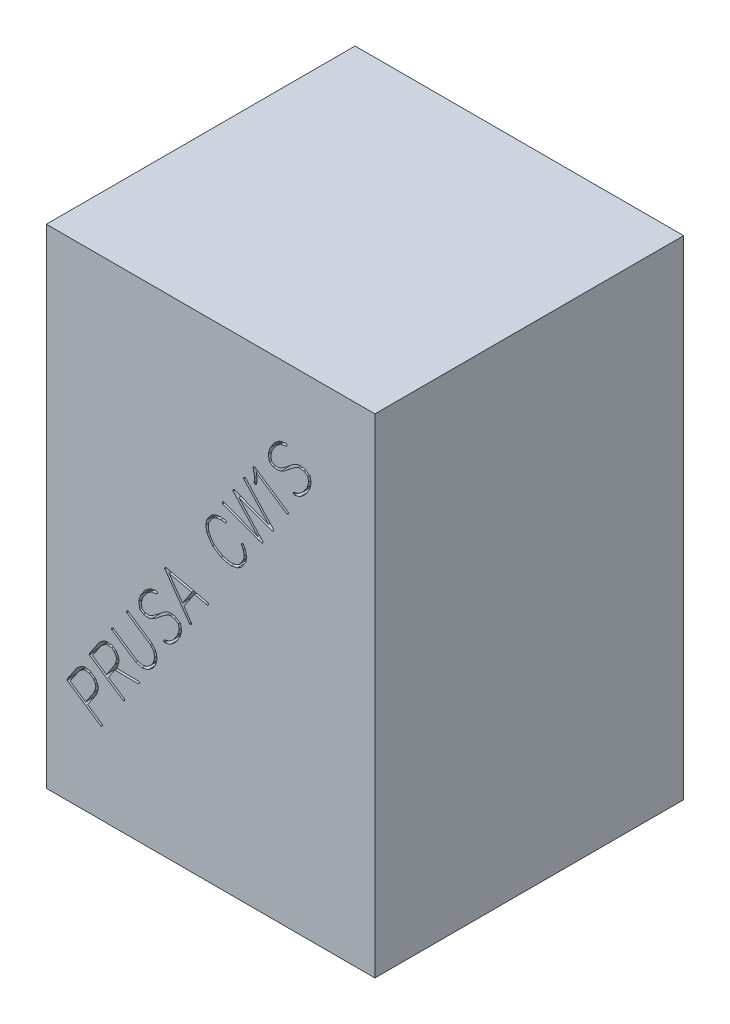
from build123d import *

# Parameters (mm, degrees)
SKETCH1_W           = 232
SKETCH1_H           = 218
BOSS_EXTRUDE1_DEPTH = 345
CUT_EXTRUDE1_DEPTH  = 10


with BuildPart() as part:
    # Sketch1 → Boss-Extrude1 (new body)
    with BuildSketch(Plane(origin=(0, 0, 0), x_dir=(1, 0, 0), z_dir=(0, 1, 0))):
        Rectangle(SKETCH1_W, SKETCH1_H)
    extrude(amount=BOSS_EXTRUDE1_DEPTH)

    # Sketch2 → Cut-Extrude1 (cut)
    # profile 1 of 9: a face of its own
    with BuildSketch(Plane.XY.offset(109)):
        with BuildLine():
            add(Edge.make_bspline(
                [(-94.375270418, 84.594757392), (-94.2712399, 84.673064857), (-94.052477044, 84.83773543), (-93.702444127, 85.095218624), (-93.320108696, 85.384684484), (-92.901429823, 85.702566451), (-92.449607078, 86.048797005), (-91.961674192, 86.423793584), (-91.441155818, 86.830251619), (-91.079341394, 87.108039316), (-90.893127561, 87.251007392)],
                knots=[0, 0, 0, 0, 0.713517633, 1.500436215, 2.381123196, 3.341333545, 4.381080633, 5.50037498, 6.713526257, 8, 8, 8, 8], degree=3))
            add(Edge.make_bspline(
                [(-90.893127561, 87.251007392), (-90.854066238, 87.260311771), (-90.759262333, 87.282893995), (-90.594154664, 87.322097448), (-90.380184097, 87.366758937), (-90.11725252, 87.41549258), (-89.804813618, 87.477215932), (-89.442757345, 87.551311043), (-89.03078555, 87.626728998), (-88.740896895, 87.684037582), (-88.588440061, 87.714177034)],
                knots=[0, 0, 0, 0, 0.409916446, 0.994889001, 1.732288869, 2.640988027, 3.724693493, 4.983422994, 6.413536459, 8, 8, 8, 8], degree=3))
            Line((-88.588440061, 87.714177034), (-85.262547203, 87.239846677))
            add(Edge.make_bspline(
                [(-85.262547203, 87.239846677), (-85.150572528, 87.169731396), (-84.912220621, 87.020482372), (-84.54141555, 86.771028734), (-84.119568016, 86.507439492), (-83.667087428, 86.204818258), (-83.170440355, 85.880254314), (-82.636932741, 85.521641908), (-82.057758208, 85.140404352), (-81.6610719, 84.872341974), (-81.456743632, 84.73426632)],
                knots=[0, 0, 0, 0, 0.69580788, 1.481112893, 2.353503564, 3.31542659, 4.347997152, 5.478374533, 6.701141545, 8, 8, 8, 8], degree=3))
            add(Edge.make_bspline(
                [(-81.456743632, 84.73426632), (-81.35119795, 84.544262041), (-81.118599691, 84.12553658), (-80.725139427, 83.444457955), (-80.263829164, 82.64723715), (-79.928231276, 82.079581368), (-79.749154346, 81.776677034)],
                knots=[0, 0, 0, 0, 0.76368351, 1.682981731, 2.763625957, 4, 4, 4, 4], degree=3))
            Line((-79.749154346, 81.776677034), (-79.297145418, 79.555694892))
            add(Edge.make_bspline(
                [(-79.297145418, 79.555694892), (-79.332261519, 79.429142852), (-79.407207073, 79.159052714), (-79.531481816, 78.73031717), (-79.66471833, 78.250201766), (-79.80934281, 77.721799304), (-79.964900858, 77.144462712), (-80.139566112, 76.520433501), (-80.32316466, 75.845052723), (-80.448681971, 75.377900455), (-80.513663275, 75.136052034)],
                knots=[0, 0, 0, 0, 0.68759803, 1.467486793, 2.337019029, 3.296221514, 4.33571337, 5.46746033, 6.688884203, 8, 8, 8, 8], degree=3))
            Line((-80.513663275, 75.136052034), (-86.864109703, 65.688507392))
            Line((-86.864109703, 65.688507392), (-76.702279346, 58.863730606))
            add(Edge.make_bspline(
                [(-76.702279346, 58.863730606), (-76.658833372, 58.805797542), (-76.571754559, 58.68968224), (-76.485637607, 58.484091426), (-76.454528133, 58.254402691), (-76.46332192, 58.097354076), (-76.467904346, 58.01551632)],
                knots=[0, 0, 0, 0, 0.957114713, 1.918346067, 2.915253814, 4, 4, 4, 4], degree=3))
            Line((-76.467904346, 58.01551632), (-76.629734703, 57.775560963))
            add(Edge.make_bspline(
                [(-76.629734703, 57.775560963), (-76.705152591, 57.677791819), (-76.845109131, 57.496356993), (-77.137601396, 57.336182511), (-77.450514723, 57.327720771), (-77.623780537, 57.420982228), (-77.712323989, 57.46864132)],
                knots=[0, 0, 0, 0, 1.162853208, 2.157961697, 3.058669304, 4, 4, 4, 4], degree=3))
            Line((-77.712323989, 57.46864132), (-101.283752561, 73.305694892))
            add(Edge.make_bspline(
                [(-101.283752561, 73.305694892), (-101.328906716, 73.372338548), (-101.416293831, 73.501314426), (-101.47531743, 73.728693005), (-101.454021207, 73.965272417), (-101.397441574, 74.114101566), (-101.367457918, 74.192971677)],
                knots=[0, 0, 0, 0, 1.021013707, 1.975974124, 2.927393266, 4, 4, 4, 4], degree=3))
            Line((-101.367457918, 74.192971677), (-94.375270418, 84.594757392))
        make_face()
        Polygon((-89.961207918, 85.599221677), (-92.969020418, 83.261052034), (-99.235761489, 74.003239534), (-88.292681132, 66.64832882), (-82.104065061, 75.861498463), (-81.060538275, 79.61707882), (-81.389779346, 81.118194892), (-82.701163275, 83.517748463), (-85.697815061, 85.526677034), (-88.393127561, 85.872659177), align=None, mode=Mode.SUBTRACT)
    # profile 2 of 9: a face of its own
    with BuildSketch(Plane.XY.offset(109)):
        with BuildLine():
            add(Edge.make_bspline(
                [(-78.630961255, 108.007630931), (-78.526931154, 108.085938941), (-78.308169171, 108.250610658), (-77.95812889, 108.508084206), (-77.575826263, 108.797593041), (-77.157007382, 109.115291583), (-76.704602587, 109.463193695), (-76.213924195, 109.83515514), (-75.689600047, 110.237246637), (-75.329191449, 110.51499556), (-75.143238041, 110.658300574)],
                knots=[0, 0, 0, 0, 0.713351082, 1.500085978, 2.380567386, 3.3405536, 4.380057987, 5.50718218, 6.71382655, 8, 8, 8, 8], degree=3))
            add(Edge.make_bspline(
                [(-75.143238041, 110.658300574), (-75.104174837, 110.667595558), (-75.009366364, 110.690154979), (-74.844308648, 110.729607821), (-74.627919642, 110.773340768), (-74.364243732, 110.829497772), (-74.049893909, 110.89111632), (-73.688269415, 110.955884019), (-73.277552081, 111.035983461), (-72.987373392, 111.091780683), (-72.832970184, 111.121470216)],
                knots=[0, 0, 0, 0, 0.408958171, 0.992563217, 1.728239241, 2.657105448, 3.738277501, 4.990486884, 6.398647109, 8, 8, 8, 8], degree=3))
            Line((-72.832970184, 111.121470216), (-69.495916612, 110.641559502))
            add(Edge.make_bspline(
                [(-69.495916612, 110.641559502), (-69.327946209, 110.538270706), (-68.951647141, 110.306875907), (-68.342307846, 109.901702687), (-67.613675671, 109.421971613), (-67.092347513, 109.072067821), (-66.811764827, 108.883747002)],
                knots=[0, 0, 0, 0, 0.737385026, 1.651941604, 2.736257535, 4, 4, 4, 4], degree=3))
            add(Edge.make_bspline(
                [(-66.811764827, 108.883747002), (-66.755882134, 108.785205307), (-66.632620552, 108.567849903), (-66.433169159, 108.211754014), (-66.197593126, 107.796563482), (-65.936873233, 107.344717099), (-65.675387743, 106.897050137), (-65.439284891, 106.494403858), (-65.245339514, 106.15506909), (-65.128355593, 105.950339906), (-65.076273755, 105.859193431)],
                knots=[0, 0, 0, 0, 0.779667771, 1.719728926, 2.809036313, 4.065078118, 5.310045176, 6.377159798, 7.277503273, 8, 8, 8, 8], degree=3))
            Line((-65.076273755, 105.859193431), (-64.663327327, 103.716336288))
            Line((-64.663327327, 103.716336288), (-64.668907684, 103.476380931))
            Line((-64.668907684, 103.476380931), (-65.818461255, 99.302273788))
            Line((-65.818461255, 99.302273788), (-66.527166612, 98.253166645))
            Line((-66.527166612, 98.253166645), (-50.902166612, 98.096916645))
            add(Edge.make_bspline(
                [(-50.902166612, 98.096916645), (-50.850883042, 98.090779931), (-50.741133171, 98.077647002), (-50.645952121, 98.021043733), (-50.595246969, 97.990889859)],
                knots=[0, 0, 0, 0, 0.934553631, 2, 2, 2, 2], degree=3))
            add(Edge.make_bspline(
                [(-50.595246969, 97.990889859), (-50.518191815, 97.933636384), (-50.378696606, 97.829988737), (-50.32012512, 97.667442518), (-50.293907684, 97.594684502)],
                knots=[0, 0, 0, 0, 1.104771347, 2, 2, 2, 2], degree=3))
            add(Edge.make_bspline(
                [(-50.293907684, 97.594684502), (-50.270756153, 97.530387005), (-50.222131984, 97.395345719), (-50.240964997, 97.158598473), (-50.337607373, 96.906280583), (-50.439572724, 96.741081467), (-50.494800541, 96.651604145)],
                knots=[0, 0, 0, 0, 0.806007807, 1.692823749, 2.750356807, 4, 4, 4, 4], degree=3))
            add(Edge.make_bspline(
                [(-50.494800541, 96.651604145), (-50.584401816, 96.586515363), (-50.76898989, 96.452425611), (-50.996926665, 96.436556112), (-51.114220184, 96.428389859)],
                knots=[0, 0, 0, 0, 0.970824099, 2, 2, 2, 2], degree=3))
            Line((-51.114220184, 96.428389859), (-67.682300541, 96.534416645))
            Line((-67.682300541, 96.534416645), (-72.191229112, 89.821247002))
            Line((-72.191229112, 89.821247002), (-60.924488041, 82.248702359))
            add(Edge.make_bspline(
                [(-60.924488041, 82.248702359), (-60.880121067, 82.191134298), (-60.793097072, 82.078216914), (-60.721426852, 81.872785017), (-60.690532021, 81.65347164), (-60.712404302, 81.504573243), (-60.723595184, 81.428389859)],
                knots=[0, 0, 0, 0, 0.991375916, 1.944543096, 2.948332109, 4, 4, 4, 4], degree=3))
            Line((-60.723595184, 81.428389859), (-60.885425541, 81.188434502))
            add(Edge.make_bspline(
                [(-60.885425541, 81.188434502), (-60.960843428, 81.090665358), (-61.100799968, 80.909230532), (-61.393292234, 80.749056051), (-61.706205561, 80.74059431), (-61.879471375, 80.833855767), (-61.968014827, 80.881514859)],
                knots=[0, 0, 0, 0, 1.162853208, 2.157961697, 3.058669304, 4, 4, 4, 4], degree=3))
            Line((-61.968014827, 80.881514859), (-85.539443398, 96.718568431))
            add(Edge.make_bspline(
                [(-85.539443398, 96.718568431), (-85.584597553, 96.785212087), (-85.671984669, 96.914187965), (-85.731008267, 97.141566544), (-85.709712044, 97.378145956), (-85.653132411, 97.526975105), (-85.623148755, 97.605845216)],
                knots=[0, 0, 0, 0, 1.021013707, 1.975974124, 2.927393266, 4, 4, 4, 4], degree=3))
            Line((-85.623148755, 97.605845216), (-78.630961255, 108.007630931))
        make_face()
        Polygon((-74.211318398, 109.006514859), (-77.224711255, 106.673925574), (-83.491452327, 97.416113074), (-73.619800541, 90.781068431), (-67.431184469, 99.994238074), (-66.426720184, 103.777720216), (-66.705738041, 105.289997002), (-68.050604112, 107.661648788), (-69.931184469, 108.928389859), (-72.637657684, 109.279952359), align=None, mode=Mode.SUBTRACT)
    # profile 3 of 9: a face of its own
    with BuildSketch(Plane.XY.offset(109)):
        with BuildLine():
            Line((-68.958080664, 121.593495541), (-68.734866378, 121.493049113))
            Line((-68.734866378, 121.493049113), (-52.044018164, 110.276531256))
            Line((-52.044018164, 110.276531256), (-48.383303878, 109.288808041))
            Line((-48.383303878, 109.288808041), (-45.068571735, 109.964031256))
            Line((-45.068571735, 109.964031256), (-41.99379495, 112.369165184))
            Line((-41.99379495, 112.369165184), (-40.565223521, 114.500861613))
            Line((-40.565223521, 114.500861613), (-39.544018164, 118.189477684))
            Line((-39.544018164, 118.189477684), (-40.169018164, 121.509790184))
            Line((-40.169018164, 121.509790184), (-42.546250307, 124.629209827))
            Line((-42.546250307, 124.629209827), (-59.237098521, 135.845727684))
            add(Edge.make_bspline(
                [(-59.237098521, 135.845727684), (-59.281608083, 135.912627373), (-59.366030128, 136.039517153), (-59.433021142, 136.255928232), (-59.425783091, 136.476090991), (-59.378433121, 136.612974613), (-59.354286021, 136.682781256)],
                knots=[0, 0, 0, 0, 1.081432516, 2.051171485, 3.006154479, 4, 4, 4, 4], degree=3))
            add(Edge.make_bspline(
                [(-59.354286021, 136.682781256), (-59.280607613, 136.787452028), (-59.148047515, 136.975772707), (-58.90837182, 137.176657381), (-58.665403357, 137.303281487), (-58.501639392, 137.28375249), (-58.422366378, 137.274299113)],
                knots=[0, 0, 0, 0, 1.303856069, 2.345860783, 3.199282941, 4, 4, 4, 4], degree=3))
            Line((-58.422366378, 137.274299113), (-58.176830664, 137.207334827))
            Line((-58.176830664, 137.207334827), (-41.301830664, 125.868049113))
            add(Edge.make_bspline(
                [(-41.301830664, 125.868049113), (-41.157190647, 125.674256902), (-40.878366246, 125.300681193), (-40.46677504, 124.764446187), (-40.090543365, 124.260193704), (-39.731829753, 123.801068638), (-39.407919102, 123.372440291), (-39.108751021, 122.98672456), (-38.838590724, 122.635916786), (-38.666233521, 122.417378966), (-38.584196735, 122.313361613)],
                knots=[0, 0, 0, 0, 1.296998481, 2.500240467, 3.625643147, 4.671316752, 5.625142876, 6.507183099, 7.289464571, 8, 8, 8, 8], degree=3))
            add(Edge.make_bspline(
                [(-38.584196735, 122.313361613), (-38.438169955, 121.620421438), (-38.146078106, 120.234359396), (-37.909893703, 118.837683807), (-37.791786021, 118.13925447)],
                knots=[0, 0, 0, 0, 0.999868914, 2, 2, 2, 2], degree=3))
            add(Edge.make_bspline(
                [(-37.791786021, 118.13925447), (-37.826184784, 117.995778086), (-37.901515158, 117.681576967), (-38.047796579, 117.17045088), (-38.207858871, 116.570166177), (-38.413407406, 115.919480976), (-38.604370342, 115.268209138), (-38.771593399, 114.676646164), (-38.909624561, 114.175756461), (-38.977722343, 113.868676583), (-39.008303878, 113.730772327)],
                knots=[0, 0, 0, 0, 0.77403987, 1.695081699, 2.789043033, 4.033284802, 5.274729183, 6.349895852, 7.258966802, 8, 8, 8, 8], degree=3))
            Line((-39.008303878, 113.730772327), (-40.760536021, 111.119165184))
            add(Edge.make_bspline(
                [(-40.760536021, 111.119165184), (-40.865041441, 111.041484086), (-41.086606641, 110.876789968), (-41.430819644, 110.606047697), (-41.81759848, 110.313073851), (-42.233951406, 109.982879239), (-42.686597096, 109.624194444), (-43.179018695, 109.241351533), (-43.701409628, 108.821946005), (-44.062194274, 108.533531959), (-44.248259235, 108.384790184)],
                knots=[0, 0, 0, 0, 0.705098585, 1.494901501, 2.371296201, 3.332500327, 4.372346951, 5.498749569, 6.710047474, 8, 8, 8, 8], degree=3))
            Line((-44.248259235, 108.384790184), (-48.416786021, 107.536575898))
            add(Edge.make_bspline(
                [(-48.416786021, 107.536575898), (-48.547081849, 107.571598999), (-48.82469116, 107.64621949), (-49.26034005, 107.770675597), (-49.745639657, 107.896609109), (-50.270381593, 108.044169256), (-50.844913643, 108.192549766), (-51.461558834, 108.361508407), (-52.125791241, 108.539449335), (-52.583450589, 108.661955855), (-52.819687807, 108.72519197)],
                knots=[0, 0, 0, 0, 0.710017342, 1.512768517, 2.384202398, 3.348348962, 4.381207657, 5.50676327, 6.713026817, 8, 8, 8, 8], degree=3))
            Line((-52.819687807, 108.72519197), (-69.795134235, 120.13144197))
            add(Edge.make_bspline(
                [(-69.795134235, 120.13144197), (-69.841191471, 120.19793998), (-69.930073121, 120.32626841), (-69.977161208, 120.556843797), (-69.969784996, 120.795943855), (-69.906528443, 120.945592679), (-69.873259235, 121.024299113)],
                knots=[0, 0, 0, 0, 1.014879786, 1.958523712, 2.926304164, 4, 4, 4, 4], degree=3))
            add(Edge.make_bspline(
                [(-69.873259235, 121.024299113), (-69.811730336, 121.107649263), (-69.69491379, 121.265894847), (-69.469389015, 121.442651841), (-69.223898325, 121.563971398), (-69.046843169, 121.583636765), (-68.958080664, 121.593495541)],
                knots=[0, 0, 0, 0, 1.106864606, 2.10145316, 3.048207482, 4, 4, 4, 4], degree=3))
        make_face()
    # profile 4 of 9: a face of its own
    with BuildSketch(Plane.XY.offset(109)):
        with BuildLine():
            add(Edge.make_bspline(
                [(-46.278198433, 156.052322103), (-46.172134829, 156.130395072), (-45.948326494, 156.295139438), (-45.594960072, 156.556923604), (-45.213802252, 156.85407641), (-44.79046938, 157.172018455), (-44.337688726, 157.523717102), (-43.842687542, 157.896198914), (-43.320440221, 158.304715438), (-42.959786667, 158.585858545), (-42.773734148, 158.730893532)],
                knots=[0, 0, 0, 0, 0.716570683, 1.512059605, 2.392617923, 3.346006394, 4.392556359, 5.511934113, 6.716466477, 8, 8, 8, 8], degree=3))
            add(Edge.make_bspline(
                [(-42.773734148, 158.730893532), (-42.675178821, 158.755180182), (-42.456148264, 158.80915513), (-42.094685616, 158.895478136), (-41.662427525, 158.972361986), (-41.168204461, 159.079721821), (-40.602724776, 159.174169045), (-39.973039489, 159.288880933), (-39.275263288, 159.404957058), (-38.787546071, 159.482683852), (-38.532662719, 159.523304246)],
                knots=[0, 0, 0, 0, 0.564491617, 1.254533029, 2.066005696, 3.005275758, 4.066497654, 5.253554587, 6.564694479, 8, 8, 8, 8], degree=3))
            add(Edge.make_bspline(
                [(-38.532662719, 159.523304246), (-38.439472749, 159.519308906), (-38.260978803, 159.511656324), (-38.104982644, 159.425141558), (-38.030430576, 159.383795318)],
                knots=[0, 0, 0, 0, 1.044180734, 2, 2, 2, 2], degree=3))
            add(Edge.make_bspline(
                [(-38.030430576, 159.383795318), (-37.988941416, 159.356518189), (-37.917264457, 159.309394033), (-37.867315517, 159.240021501), (-37.846278791, 159.210804246)],
                knots=[0, 0, 0, 0, 1.157670781, 2, 2, 2, 2], degree=3))
            add(Edge.make_bspline(
                [(-37.846278791, 159.210804246), (-37.799479719, 159.15174841), (-37.708530797, 159.036979797), (-37.640409346, 158.82539172), (-37.634377467, 158.59848763), (-37.67817957, 158.451149642), (-37.701189505, 158.373750675)],
                knots=[0, 0, 0, 0, 1.003360566, 1.949922457, 2.923061945, 4, 4, 4, 4], degree=3))
            add(Edge.make_bspline(
                [(-37.701189505, 158.373750675), (-37.751796369, 158.301798666), (-37.844161709, 158.170475145), (-37.991879252, 158.006849216), (-38.126763212, 157.879704996), (-38.22986892, 157.83934141), (-38.275966291, 157.821295318)],
                knots=[0, 0, 0, 0, 1.30031508, 2.373275733, 3.272710371, 4, 4, 4, 4], degree=3))
            Line((-38.275966291, 157.821295318), (-41.986903791, 157.168393532))
            Line((-41.986903791, 157.168393532), (-45.089582362, 154.80790246))
            Line((-45.089582362, 154.80790246), (-48.024850219, 150.43290246))
            Line((-48.024850219, 150.43290246), (-49.062796648, 146.794509603))
            Line((-49.062796648, 146.794509603), (-48.426635933, 143.55790246))
            Line((-48.426635933, 143.55790246), (-46.652082362, 142.363706032))
            Line((-46.652082362, 142.363706032), (-43.995832362, 142.056786389))
            Line((-43.995832362, 142.056786389), (-42.450073433, 142.402768532))
            Line((-42.450073433, 142.402768532), (-39.871948433, 143.920625675))
            Line((-39.871948433, 143.920625675), (-33.175519862, 149.121518532))
            Line((-33.175519862, 149.121518532), (-30.530430576, 150.600313175))
            add(Edge.make_bspline(
                [(-30.530430576, 150.600313175), (-30.356095707, 150.643765591), (-29.973056839, 150.739236819), (-29.335444418, 150.835297347), (-28.59200221, 150.939555778), (-28.058601946, 150.991238357), (-27.773734148, 151.01883996)],
                knots=[0, 0, 0, 0, 0.772074916, 1.696360011, 2.769717798, 4, 4, 4, 4], degree=3))
            Line((-27.773734148, 151.01883996), (-25.111903791, 150.650536389))
            add(Edge.make_bspline(
                [(-25.111903791, 150.650536389), (-25.001951972, 150.582034913), (-24.769817739, 150.437412132), (-24.404112763, 150.199968953), (-24.001347067, 149.934491632), (-23.557422025, 149.641473684), (-23.073275895, 149.326990879), (-22.553304972, 148.976896941), (-21.990805363, 148.60691983), (-21.605289061, 148.346284006), (-21.406546648, 148.211920318)],
                knots=[0, 0, 0, 0, 0.700862332, 1.47968576, 2.358929898, 3.310743754, 4.357475362, 5.482326936, 6.702082333, 8, 8, 8, 8], degree=3))
            Line((-21.406546648, 148.211920318), (-21.227975219, 147.899420318))
            Line((-21.227975219, 147.899420318), (-20.508109148, 143.915045318))
            add(Edge.make_bspline(
                [(-20.508109148, 143.915045318), (-20.537086904, 143.766077152), (-20.603629028, 143.423998968), (-20.73808887, 142.845655425), (-20.938858625, 142.141570389), (-21.086522904, 141.627063462), (-21.166591291, 141.348081032)],
                knots=[0, 0, 0, 0, 0.686852678, 1.577231729, 2.686296055, 4, 4, 4, 4], degree=3))
            Line((-21.166591291, 141.348081032), (-21.713466291, 139.450759603))
            Line((-21.713466291, 139.450759603), (-24.972394862, 134.595848889))
            add(Edge.make_bspline(
                [(-24.972394862, 134.595848889), (-25.072643045, 134.513758058), (-25.283474463, 134.34111327), (-25.622326654, 134.072227773), (-25.994013992, 133.772333015), (-26.400035714, 133.440935796), (-26.850589744, 133.09083705), (-27.331336748, 132.705866276), (-27.854746395, 132.29804499), (-28.212928106, 132.0142647), (-28.398734148, 131.867054246)],
                knots=[0, 0, 0, 0, 0.709922585, 1.493034391, 2.370061724, 3.32667973, 4.364492557, 5.496194692, 6.701156037, 8, 8, 8, 8], degree=3))
            Line((-28.398734148, 131.867054246), (-28.661010933, 131.749866746))
            Line((-28.661010933, 131.749866746), (-32.444493076, 130.845848889))
            add(Edge.make_bspline(
                [(-32.444493076, 130.845848889), (-32.518285191, 130.867281298), (-32.71275745, 130.923764419), (-32.881237248, 131.037528901), (-32.985787719, 131.108125675)],
                knots=[0, 0, 0, 0, 0.75889605, 2, 2, 2, 2], degree=3))
            add(Edge.make_bspline(
                [(-32.985787719, 131.108125675), (-33.028835969, 131.17324487), (-33.11373872, 131.301677474), (-33.170834873, 131.524708711), (-33.188076259, 131.758471155), (-33.146858243, 131.910364848), (-33.125296648, 131.989822103)],
                knots=[0, 0, 0, 0, 1.003181253, 1.978543799, 2.942554112, 4, 4, 4, 4], degree=3))
            add(Edge.make_bspline(
                [(-33.125296648, 131.989822103), (-33.074832969, 132.061804989), (-32.982007808, 132.194213548), (-32.833225602, 132.356562687), (-32.690784176, 132.472065976), (-32.590667669, 132.512601957), (-32.544939505, 132.531116746)],
                knots=[0, 0, 0, 0, 1.305480124, 2.401358853, 3.269821468, 4, 4, 4, 4], degree=3))
            Line((-32.544939505, 132.531116746), (-29.157662719, 133.407232818))
            Line((-29.157662719, 133.407232818), (-26.227975219, 135.812366746))
            Line((-26.227975219, 135.812366746), (-23.270385933, 140.215268532))
            Line((-23.270385933, 140.215268532), (-22.271502005, 143.87040246))
            Line((-22.271502005, 143.87040246), (-22.857439505, 147.11258996))
            Line((-22.857439505, 147.11258996), (-25.697841291, 149.021072103))
            Line((-25.697841291, 149.021072103), (-28.348510933, 149.327991746))
            Line((-28.348510933, 149.327991746), (-29.972394862, 148.998750675))
            Line((-29.972394862, 148.998750675), (-32.550519862, 147.480893532))
            Line((-32.550519862, 147.480893532), (-39.179984148, 142.302322103))
            Line((-39.179984148, 142.302322103), (-41.836234148, 140.790045318))
            add(Edge.make_bspline(
                [(-41.836234148, 140.790045318), (-42.085234038, 140.731226701), (-42.578523061, 140.61470224), (-43.074826969, 140.511775939), (-43.320609148, 140.460804246)],
                knots=[0, 0, 0, 0, 1.009549692, 2, 2, 2, 2], degree=3))
            add(Edge.make_bspline(
                [(-43.320609148, 140.460804246), (-43.465195353, 140.429234347), (-43.737670845, 140.369740262), (-44.126889138, 140.341143618), (-44.46982009, 140.334873629), (-44.675217728, 140.382619048), (-44.771502005, 140.405000675)],
                knots=[0, 0, 0, 0, 1.209672379, 2.27965094, 3.193551748, 4, 4, 4, 4], degree=3))
            add(Edge.make_bspline(
                [(-44.771502005, 140.405000675), (-44.845961466, 140.415783651), (-45.013636237, 140.440065764), (-45.292949263, 140.490337082), (-45.633299808, 140.521484373), (-46.012004017, 140.573956759), (-46.395554493, 140.619417634), (-46.744680799, 140.666930103), (-47.044996621, 140.697273035), (-47.22691853, 140.722597703), (-47.310564505, 140.734241746)],
                knots=[0, 0, 0, 0, 0.705190142, 1.58801305, 2.658509566, 3.906279079, 5.171346789, 6.278553461, 7.208495152, 8, 8, 8, 8], degree=3))
            Line((-47.310564505, 140.734241746), (-49.816144862, 142.419509603))
            add(Edge.make_bspline(
                [(-49.816144862, 142.419509603), (-49.853582821, 142.449207628), (-49.932580415, 142.511873237), (-50.014770981, 142.654268955), (-50.074200518, 142.828555376), (-50.110345712, 143.026545775), (-50.122117257, 143.216477265), (-50.152721997, 143.369277277), (-50.156614044, 143.473231072), (-50.169193232, 143.524480014), (-50.173287719, 143.541161389)],
                knots=[0, 0, 0, 0, 0.939124021, 1.98163954, 3.193297113, 4.5803863, 5.951240155, 6.956652948, 7.660393704, 8, 8, 8, 8], degree=3))
            Line((-50.173287719, 143.541161389), (-50.792707362, 146.671741746))
            Line((-50.792707362, 146.671741746), (-50.759225219, 146.99540246))
            add(Edge.make_bspline(
                [(-50.759225219, 146.99540246), (-50.726201399, 147.122015355), (-50.656612739, 147.388817364), (-50.537428141, 147.806294573), (-50.408920465, 148.26807571), (-50.265466199, 148.772660224), (-50.101848551, 149.318468933), (-49.929670606, 149.907059019), (-49.739480428, 150.537513951), (-49.606128047, 150.972391173), (-49.537127005, 151.197411389)],
                knots=[0, 0, 0, 0, 0.717548049, 1.512036055, 2.380786382, 3.346208911, 4.38874324, 5.505537772, 6.709280688, 8, 8, 8, 8], degree=3))
            Line((-49.537127005, 151.197411389), (-49.481323433, 151.353661389))
            Line((-49.481323433, 151.353661389), (-46.278198433, 156.052322103))
        make_face()
    # profile 5 of 9: a face of its own
    with BuildSketch(Plane.XY.offset(109)):
        with BuildLine():
            Line((-31.50964091, 177.292010477), (-2.011873053, 170.562099762))
            add(Edge.make_bspline(
                [(-2.011873053, 170.562099762), (-1.946338649, 170.516337609), (-1.823331476, 170.430442678), (-1.681506379, 170.267681092), (-1.57561528, 170.101858407), (-1.525544732, 169.919809155), (-1.513334088, 169.731325931), (-1.549007802, 169.53061116), (-1.636278379, 169.324939663), (-1.717970028, 169.191997584), (-1.760756982, 169.12236762)],
                knots=[0, 0, 0, 0, 1.141347822, 2.142294118, 3.075217523, 3.935991521, 4.817578893, 5.764497877, 6.829129687, 8, 8, 8, 8], degree=3))
            add(Edge.make_bspline(
                [(-1.760756982, 169.12236762), (-1.837013342, 169.076875989), (-1.989339263, 168.986004164), (-2.260020029, 168.929948294), (-2.553551371, 168.914984134), (-2.754450242, 168.955810777), (-2.860087339, 168.977278334)],
                knots=[0, 0, 0, 0, 0.927601052, 1.852929835, 2.871022736, 4, 4, 4, 4], degree=3))
            add(Edge.make_bspline(
                [(-2.860087339, 168.977278334), (-3.039072553, 169.018462677), (-3.400616401, 169.101653605), (-3.757095193, 169.204410121), (-3.937096267, 169.256296191)],
                knots=[0, 0, 0, 0, 0.99011622, 2, 2, 2, 2], degree=3))
            Line((-3.937096267, 169.256296191), (-11.464998053, 170.885760477))
            Line((-11.464998053, 170.885760477), (-18.81432841, 159.94268012))
            Line((-18.81432841, 159.94268012), (-13.602274839, 152.269689048))
            add(Edge.make_bspline(
                [(-13.602274839, 152.269689048), (-13.56614392, 152.208262935), (-13.495467102, 152.0881054), (-13.466918755, 151.875284669), (-13.517801382, 151.657510599), (-13.594566952, 151.525688542), (-13.635756982, 151.454956905)],
                knots=[0, 0, 0, 0, 0.974428207, 1.906109407, 2.876483109, 4, 4, 4, 4], degree=3))
            add(Edge.make_bspline(
                [(-13.635756982, 151.454956905), (-13.695006778, 151.375075403), (-13.804560729, 151.227373052), (-14.016616668, 151.071547356), (-14.255033685, 151.008235089), (-14.409573943, 151.034169339), (-14.489551625, 151.047590834)],
                knots=[0, 0, 0, 0, 1.17106085, 2.165312797, 3.050512586, 4, 4, 4, 4], degree=3))
            add(Edge.make_bspline(
                [(-14.489551625, 151.047590834), (-14.507849314, 151.057700187), (-14.556721123, 151.08470154), (-14.649631192, 151.100966515), (-14.747564773, 151.137440706), (-14.807966662, 151.171537957), (-14.835533767, 151.187099762)],
                knots=[0, 0, 0, 0, 0.666385548, 1.779867742, 2.986743299, 4, 4, 4, 4], degree=3))
            add(Edge.make_bspline(
                [(-14.835533767, 151.187099762), (-14.871498446, 151.212677546), (-14.928340498, 151.253103148), (-14.966578656, 151.310944605), (-14.980623053, 151.332189048)],
                knots=[0, 0, 0, 0, 1.265425045, 2, 2, 2, 2], degree=3))
            Line((-14.980623053, 151.332189048), (-32.346694482, 176.042010477))
            add(Edge.make_bspline(
                [(-32.346694482, 176.042010477), (-32.370474368, 176.108262057), (-32.41770461, 176.239847136), (-32.429622762, 176.449564194), (-32.412346137, 176.66216041), (-32.357893023, 176.794447271), (-32.32995341, 176.862322977)],
                knots=[0, 0, 0, 0, 0.995865192, 1.977930199, 2.962486406, 4, 4, 4, 4], degree=3))
            add(Edge.make_bspline(
                [(-32.32995341, 176.862322977), (-32.275566117, 176.934149505), (-32.173628723, 177.06877303), (-31.975152595, 177.218552835), (-31.747466746, 177.294465591), (-31.590123291, 177.292841309), (-31.50964091, 177.292010477)],
                knots=[0, 0, 0, 0, 1.105665884, 2.072335144, 3.01398469, 4, 4, 4, 4], degree=3))
        make_face()
        Polygon((-19.863435553, 161.471697977), (-13.284194482, 171.265224762), (-29.43932841, 174.959421191), align=None, mode=Mode.SUBTRACT)
    # profile 6 of 9: a face of its own
    with BuildSketch(Plane.XY.offset(109)):
        with BuildLine():
            Line((3.136672614, 226.878214663), (7.221494043, 227.614821806))
            Line((7.221494043, 227.614821806), (10.597610114, 227.162812877))
            add(Edge.make_bspline(
                [(10.597610114, 227.162812877), (10.676514818, 227.104418132), (10.825674836, 226.994029766), (10.998712521, 226.79010281), (11.108126703, 226.562386184), (11.124885615, 226.401294882), (11.1333244, 226.320178949)],
                knots=[0, 0, 0, 0, 1.13177318, 2.139483442, 3.063155271, 4, 4, 4, 4], degree=3))
            add(Edge.make_bspline(
                [(11.1333244, 226.320178949), (11.107976107, 226.219917233), (11.069516676, 226.067796196), (11.000576632, 225.927245597), (10.9770744, 225.879330734)],
                knots=[0, 0, 0, 0, 1.318183447, 2, 2, 2, 2], degree=3))
            add(Edge.make_bspline(
                [(10.9770744, 225.879330734), (10.946083754, 225.832377332), (10.893130769, 225.752149162), (10.818355447, 225.692158422), (10.787342257, 225.667277163)],
                knots=[0, 0, 0, 0, 1.170496657, 2, 2, 2, 2], degree=3))
            add(Edge.make_bspline(
                [(10.787342257, 225.667277163), (10.753521244, 225.638490101), (10.682084578, 225.577686133), (10.532934646, 225.538595317), (10.355905292, 225.520750098), (10.227453866, 225.536075257), (10.1567619, 225.544509306)],
                knots=[0, 0, 0, 0, 0.792555087, 1.674033073, 2.719927207, 4, 4, 4, 4], degree=3))
            Line((10.1567619, 225.544509306), (7.271717257, 225.923973592))
            Line((7.271717257, 225.923973592), (3.739351185, 225.259911092))
            Line((3.739351185, 225.259911092), (1.423502971, 223.970848592))
            Line((1.423502971, 223.970848592), (-1.388997029, 219.785580734))
            Line((-1.388997029, 219.785580734), (-1.684755957, 217.190714663))
            Line((-1.684755957, 217.190714663), (-1.0541756, 213.730893234))
            Line((-1.0541756, 213.730893234), (0.402297614, 211.130446806))
            Line((0.402297614, 211.130446806), (2.746047614, 208.139375377))
            Line((2.746047614, 208.139375377), (8.147833328, 204.506562877))
            Line((8.147833328, 204.506562877), (11.987119043, 203.451875377))
            Line((11.987119043, 203.451875377), (14.715913685, 203.184018234))
            Line((14.715913685, 203.184018234), (18.136672614, 203.870402163))
            Line((18.136672614, 203.870402163), (20.419038685, 205.181786092))
            Line((20.419038685, 205.181786092), (23.231538685, 209.367053949))
            Line((23.231538685, 209.367053949), (23.6333244, 211.939598592))
            Line((23.6333244, 211.939598592), (23.058547614, 215.315714663))
            Line((23.058547614, 215.315714663), (21.708101185, 217.882678949))
            add(Edge.make_bspline(
                [(21.708101185, 217.882678949), (21.698709456, 217.945992251), (21.678956272, 218.079156149), (21.728284005, 218.290763073), (21.817857306, 218.518000654), (21.91337224, 218.663640988), (21.964797614, 218.742053949)],
                knots=[0, 0, 0, 0, 0.826847757, 1.739070101, 2.782712167, 4, 4, 4, 4], degree=3))
            add(Edge.make_bspline(
                [(21.964797614, 218.742053949), (22.03673919, 218.798329022), (22.170247901, 218.902763938), (22.397825223, 218.990277219), (22.628481409, 219.015539204), (22.769274128, 218.963729023), (22.840913685, 218.937366449)],
                knots=[0, 0, 0, 0, 1.147177408, 2.128924401, 3.047940619, 4, 4, 4, 4], degree=3))
            Line((22.840913685, 218.937366449), (23.131092257, 218.742053949))
            add(Edge.make_bspline(
                [(23.131092257, 218.742053949), (23.225726206, 218.56149969), (23.43586948, 218.160562573), (23.786101599, 217.506066792), (24.201140992, 216.737957307), (24.49994385, 216.189864239), (24.660110114, 215.896071806)],
                knots=[0, 0, 0, 0, 0.75716251, 1.681348072, 2.757141019, 4, 4, 4, 4], degree=3))
            Line((24.660110114, 215.896071806), (25.368815471, 211.889375377))
            Line((25.368815471, 211.889375377), (24.8833244, 208.742053949))
            Line((24.8833244, 208.742053949), (21.590913685, 203.842500377))
            Line((21.590913685, 203.842500377), (18.806315471, 202.229777163))
            Line((18.806315471, 202.229777163), (14.626627971, 201.420625377))
            Line((14.626627971, 201.420625377), (11.384440471, 201.878214663))
            Line((11.384440471, 201.878214663), (7.361002971, 202.966384306))
            Line((7.361002971, 202.966384306), (1.4458244, 206.939598592))
            add(Edge.make_bspline(
                [(1.4458244, 206.939598592), (1.361488977, 207.043272039), (1.182529941, 207.263266197), (0.913911937, 207.620467137), (0.614462521, 208.008827082), (0.306804918, 208.444366838), (-0.045715699, 208.902363967), (-0.402411362, 209.412232522), (-0.790529606, 209.95318276), (-1.05272927, 210.328440544), (-1.188104172, 210.522187877)],
                knots=[0, 0, 0, 0, 0.721117377, 1.530204828, 2.411533815, 3.367236786, 4.407155985, 5.529686727, 6.724565805, 8, 8, 8, 8], degree=3))
            Line((-1.188104172, 210.522187877), (-2.672479172, 213.089152163))
            Line((-2.672479172, 213.089152163), (-3.4369881, 217.224196806))
            add(Edge.make_bspline(
                [(-3.4369881, 217.224196806), (-3.413690555, 217.432637961), (-3.361814234, 217.896770993), (-3.254038246, 218.663388458), (-3.106440396, 219.568344297), (-2.998196319, 220.219022122), (-2.940336315, 220.566830734)],
                knots=[0, 0, 0, 0, 0.744635496, 1.658069544, 2.748161455, 4, 4, 4, 4], degree=3))
            Line((-2.940336315, 220.566830734), (0.2739494, 225.276652163))
            Line((0.2739494, 225.276652163), (3.136672614, 226.878214663))
        make_face()
    # profile 7 of 9: a face of its own
    with BuildSketch(Plane.XY.offset(109)):
        with BuildLine():
            Line((9.148838919, 237.729704274), (33.283883562, 228.711847131))
            Line((33.283883562, 228.711847131), (15.873169277, 247.662739988))
            add(Edge.make_bspline(
                [(15.873169277, 247.662739988), (15.836711507, 247.726106625), (15.764341865, 247.851891085), (15.740977595, 248.076715076), (15.776983194, 248.3139657), (15.843184337, 248.467521736), (15.878749634, 248.550016774)],
                knots=[0, 0, 0, 0, 0.93321781, 1.852462179, 2.846276449, 4, 4, 4, 4], degree=3))
            add(Edge.make_bspline(
                [(15.878749634, 248.550016774), (15.932909387, 248.622164944), (16.035328836, 248.758601604), (16.238395021, 248.904766191), (16.468437926, 248.982934315), (16.627796515, 248.98080542), (16.710222848, 248.979704274)],
                knots=[0, 0, 0, 0, 1.094331564, 2.069448792, 3.001445369, 4, 4, 4, 4], degree=3))
            Line((16.710222848, 248.979704274), (16.989240705, 248.890418559))
            Line((16.989240705, 248.890418559), (40.845267491, 239.961847131))
            Line((40.845267491, 239.961847131), (23.406651419, 258.879257845))
            add(Edge.make_bspline(
                [(23.406651419, 258.879257845), (23.362391438, 258.930424586), (23.27615731, 259.030115529), (23.234722729, 259.231303045), (23.253138403, 259.448297603), (23.31274008, 259.589194309), (23.345267491, 259.666088202)],
                knots=[0, 0, 0, 0, 0.945468895, 1.842108435, 2.822338101, 4, 4, 4, 4], degree=3))
            add(Edge.make_bspline(
                [(23.345267491, 259.666088202), (23.407392826, 259.752351919), (23.523546052, 259.9136357), (23.728454413, 260.100558253), (23.945983288, 260.220553746), (24.097325011, 260.237955515), (24.171160348, 260.246445345)],
                knots=[0, 0, 0, 0, 1.214221787, 2.270181332, 3.156070502, 4, 4, 4, 4], degree=3))
            add(Edge.make_bspline(
                [(24.171160348, 260.246445345), (24.237831772, 260.246149069), (24.39705568, 260.245441508), (24.529463296, 260.154321574), (24.606428205, 260.101356059)],
                knots=[0, 0, 0, 0, 0.837454941, 2, 2, 2, 2], degree=3))
            add(Edge.make_bspline(
                [(24.606428205, 260.101356059), (24.655850153, 260.069029049), (24.737719199, 260.015478315), (24.795558406, 259.937105141), (24.818481777, 259.906043559)],
                knots=[0, 0, 0, 0, 1.207341483, 2, 2, 2, 2], degree=3))
            Line((24.818481777, 259.906043559), (44.366472848, 238.583498916))
            add(Edge.make_bspline(
                [(44.366472848, 238.583498916), (44.402512813, 238.506858357), (44.471406109, 238.360353755), (44.501736728, 238.119069629), (44.454850912, 237.881240516), (44.374523427, 237.740888367), (44.332990705, 237.668320345)],
                knots=[0, 0, 0, 0, 1.046975316, 2.001377625, 2.966627343, 4, 4, 4, 4], degree=3))
            add(Edge.make_bspline(
                [(44.332990705, 237.668320345), (44.273805203, 237.588202545), (44.164370135, 237.440063277), (43.95115391, 237.286749738), (43.714694017, 237.214126133), (43.559343431, 237.241335997), (43.479196062, 237.255373916)],
                knots=[0, 0, 0, 0, 1.169389962, 2.162223296, 3.051867329, 4, 4, 4, 4], degree=3))
            Line((43.479196062, 237.255373916), (19.935669277, 245.826802488))
            Line((19.935669277, 245.826802488), (36.810669277, 227.333498916))
            add(Edge.make_bspline(
                [(36.810669277, 227.333498916), (36.847828123, 227.277612703), (36.920185563, 227.168788458), (36.966957383, 226.971118897), (36.948103888, 226.75884997), (36.891008394, 226.623592543), (36.860892491, 226.552248916)],
                knots=[0, 0, 0, 0, 0.96647846, 1.881971969, 2.882813283, 4, 4, 4, 4], degree=3))
            add(Edge.make_bspline(
                [(36.860892491, 226.552248916), (36.816436209, 226.483698755), (36.735338303, 226.358648384), (36.596981582, 226.209815955), (36.482549267, 226.091655752), (36.324854906, 225.990751392), (36.052308805, 225.989621383), (35.846442709, 226.05170276), (35.722499634, 226.089079274)],
                knots=[0, 0, 0, 0, 1.059067261, 1.931968513, 2.632710045, 3.196294896, 4.312010381, 6, 6, 6, 6], degree=3))
            Line((35.722499634, 226.089079274), (33.875401419, 226.736400702))
            Line((33.875401419, 226.736400702), (8.529419277, 236.172784631))
            add(Edge.make_bspline(
                [(8.529419277, 236.172784631), (8.464914677, 236.221687445), (8.345829744, 236.311969198), (8.219984154, 236.489241938), (8.155905006, 236.688677095), (8.177810802, 236.823617261), (8.189017491, 236.892650702)],
                knots=[0, 0, 0, 0, 1.135467786, 2.096239741, 3.026063734, 4, 4, 4, 4], degree=3))
            add(Edge.make_bspline(
                [(8.189017491, 236.892650702), (8.195294755, 236.964926382), (8.209088458, 237.123745475), (8.293622821, 237.259515409), (8.339687134, 237.333498916)],
                knots=[0, 0, 0, 0, 0.910163616, 2, 2, 2, 2], degree=3))
            add(Edge.make_bspline(
                [(8.339687134, 237.333498916), (8.394970474, 237.410224937), (8.496759627, 237.551494922), (8.701898338, 237.691273661), (8.923716086, 237.764558083), (9.072239582, 237.741563483), (9.148838919, 237.729704274)],
                knots=[0, 0, 0, 0, 1.169155765, 2.152680617, 3.047265626, 4, 4, 4, 4], degree=3))
        make_face()
    # profile 8 of 9: a face of its own
    with BuildSketch(Plane.XY.offset(109)):
        with BuildLine():
            Line((30.829813304, 270.133624965), (31.164634733, 270.055499965))
            Line((31.164634733, 270.055499965), (54.736063304, 254.212866036))
            add(Edge.make_bspline(
                [(54.736063304, 254.212866036), (54.791227719, 254.152929936), (54.898625339, 254.036242491), (54.976557612, 253.801432938), (54.952649266, 253.540915519), (54.880953091, 253.375947739), (54.84209009, 253.28652675)],
                knots=[0, 0, 0, 0, 0.960385219, 1.869739556, 2.84528969, 4, 4, 4, 4], degree=3))
            add(Edge.make_bspline(
                [(54.84209009, 253.28652675), (54.774439695, 253.194722993), (54.651174787, 253.027448556), (54.4396883, 252.831518712), (54.210306287, 252.72910966), (54.059705807, 252.73626086), (53.988295447, 252.73965175)],
                knots=[0, 0, 0, 0, 1.277315285, 2.327379631, 3.206892163, 4, 4, 4, 4], degree=3))
            Line((53.988295447, 252.73965175), (53.781822233, 252.784294608))
            Line((53.781822233, 252.784294608), (32.174679376, 267.304383893))
            Line((32.174679376, 267.304383893), (32.877804376, 263.459517822))
            Line((32.877804376, 263.459517822), (32.38115259, 260.172687465))
            add(Edge.make_bspline(
                [(32.38115259, 260.172687465), (32.373403052, 260.140415917), (32.356648304, 260.070643798), (32.318142845, 260.009980044), (32.297447233, 259.977374965)],
                knots=[0, 0, 0, 0, 0.92505567, 2, 2, 2, 2], degree=3))
            add(Edge.make_bspline(
                [(32.297447233, 259.977374965), (32.226420723, 259.894347491), (32.080762123, 259.724077747), (31.756808302, 259.594119), (31.386013964, 259.57900914), (31.167092895, 259.697830879), (31.05302759, 259.759741036)],
                knots=[0, 0, 0, 0, 0.926024528, 1.899057639, 2.90533775, 4, 4, 4, 4], degree=3))
            add(Edge.make_bspline(
                [(31.05302759, 259.759741036), (31.010673418, 259.78978236), (30.930602285, 259.846575887), (30.865880443, 259.920317876), (30.835393662, 259.955053536)],
                knots=[0, 0, 0, 0, 1.05791365, 2, 2, 2, 2], degree=3))
            add(Edge.make_bspline(
                [(30.835393662, 259.955053536), (30.785182636, 260.057176808), (30.69233673, 260.246014373), (30.694768201, 260.455812403), (30.695884733, 260.55215175)],
                knots=[0, 0, 0, 0, 1.081599117, 2, 2, 2, 2], degree=3))
            Line((30.695884733, 260.55215175), (31.080929376, 263.431616036))
            Line((31.080929376, 263.431616036), (29.953697233, 269.173803536))
            add(Edge.make_bspline(
                [(29.953697233, 269.173803536), (29.95076119, 269.255404303), (29.944223749, 269.437097887), (30.03668823, 269.594761204), (30.087625804, 269.681616036)],
                knots=[0, 0, 0, 0, 0.898223975, 2, 2, 2, 2], degree=3))
            add(Edge.make_bspline(
                [(30.087625804, 269.681616036), (30.130141247, 269.735732909), (30.216237304, 269.845322487), (30.388356349, 269.974979664), (30.596729396, 270.070557761), (30.74905652, 270.111774016), (30.829813304, 270.133624965)],
                knots=[0, 0, 0, 0, 0.92534057, 1.873864439, 2.872821412, 4, 4, 4, 4], degree=3))
        make_face()
    # profile 9 of 9: a face of its own
    with BuildSketch(Plane.XY.offset(109)):
        with BuildLine():
            add(Edge.make_bspline(
                [(45.198230752, 292.084081021), (45.304294356, 292.16215399), (45.528102691, 292.326898355), (45.881469113, 292.588682521), (46.262626933, 292.885835328), (46.685959805, 293.203777373), (47.138740459, 293.55547602), (47.633741643, 293.927957831), (48.155988964, 294.336474355), (48.516642518, 294.617617462), (48.702695037, 294.762652449)],
                knots=[0, 0, 0, 0, 0.716570683, 1.512059605, 2.392617923, 3.346006394, 4.392556359, 5.511934113, 6.716466477, 8, 8, 8, 8], degree=3))
            add(Edge.make_bspline(
                [(48.702695037, 294.762652449), (48.801250365, 294.7869391), (49.020280921, 294.840914047), (49.381743569, 294.927237053), (49.81400166, 295.004120903), (50.308224724, 295.111480739), (50.873704409, 295.205927962), (51.503389696, 295.32063985), (52.201165898, 295.436715976), (52.688883114, 295.514442769), (52.943766466, 295.555063164)],
                knots=[0, 0, 0, 0, 0.564491617, 1.254533029, 2.066005696, 3.005275758, 4.066497654, 5.253554587, 6.564694479, 8, 8, 8, 8], degree=3))
            add(Edge.make_bspline(
                [(52.943766466, 295.555063164), (53.036956436, 295.551067824), (53.215450382, 295.543415241), (53.371446541, 295.456900475), (53.445998609, 295.415554235)],
                knots=[0, 0, 0, 0, 1.044180734, 2, 2, 2, 2], degree=3))
            add(Edge.make_bspline(
                [(53.445998609, 295.415554235), (53.487487769, 295.388277106), (53.559164728, 295.341152951), (53.609113668, 295.271780419), (53.630150394, 295.242563164)],
                knots=[0, 0, 0, 0, 1.157670781, 2, 2, 2, 2], degree=3))
            add(Edge.make_bspline(
                [(53.630150394, 295.242563164), (53.676949466, 295.183507328), (53.767898388, 295.068738714), (53.836019839, 294.857150638), (53.842051718, 294.630246548), (53.798249615, 294.48290856), (53.77523968, 294.405509592)],
                knots=[0, 0, 0, 0, 1.003360566, 1.949922457, 2.923061945, 4, 4, 4, 4], degree=3))
            add(Edge.make_bspline(
                [(53.77523968, 294.405509592), (53.724632816, 294.333557584), (53.632267477, 294.202234062), (53.484549933, 294.038608134), (53.349665973, 293.911463913), (53.246560265, 293.871100328), (53.200462894, 293.853054235)],
                knots=[0, 0, 0, 0, 1.30031508, 2.373275733, 3.272710371, 4, 4, 4, 4], degree=3))
            Line((53.200462894, 293.853054235), (49.489525394, 293.200152449))
            Line((49.489525394, 293.200152449), (46.386846823, 290.839661378))
            Line((46.386846823, 290.839661378), (43.451578966, 286.464661378))
            Line((43.451578966, 286.464661378), (42.413632537, 282.826268521))
            Line((42.413632537, 282.826268521), (43.049793252, 279.589661378))
            Line((43.049793252, 279.589661378), (44.824346823, 278.395464949))
            Line((44.824346823, 278.395464949), (47.480596823, 278.088545306))
            Line((47.480596823, 278.088545306), (49.026355752, 278.434527449))
            Line((49.026355752, 278.434527449), (51.604480752, 279.952384592))
            Line((51.604480752, 279.952384592), (58.300909323, 285.153277449))
            Line((58.300909323, 285.153277449), (60.945998609, 286.632072092))
            add(Edge.make_bspline(
                [(60.945998609, 286.632072092), (61.120333478, 286.675524508), (61.503372346, 286.770995736), (62.140984767, 286.867056264), (62.884426975, 286.971314695), (63.417827239, 287.022997274), (63.702695037, 287.050598878)],
                knots=[0, 0, 0, 0, 0.772074916, 1.696360011, 2.769717798, 4, 4, 4, 4], degree=3))
            Line((63.702695037, 287.050598878), (66.364525394, 286.682295306))
            add(Edge.make_bspline(
                [(66.364525394, 286.682295306), (66.474477213, 286.61379383), (66.706611446, 286.46917105), (67.072316422, 286.231727871), (67.475082118, 285.96625055), (67.91900716, 285.673232602), (68.40315329, 285.358749796), (68.923124213, 285.008655859), (69.485623822, 284.638678748), (69.871140124, 284.378042924), (70.069882537, 284.243679235)],
                knots=[0, 0, 0, 0, 0.700862332, 1.47968576, 2.358929898, 3.310743754, 4.357475362, 5.482326936, 6.702082333, 8, 8, 8, 8], degree=3))
            Line((70.069882537, 284.243679235), (70.248453966, 283.931179235))
            Line((70.248453966, 283.931179235), (70.968320037, 279.946804235))
            add(Edge.make_bspline(
                [(70.968320037, 279.946804235), (70.939342281, 279.79783607), (70.872800157, 279.455757885), (70.738340315, 278.877414342), (70.53757056, 278.173329306), (70.389906281, 277.658822379), (70.309837894, 277.379839949)],
                knots=[0, 0, 0, 0, 0.686852678, 1.577231729, 2.686296055, 4, 4, 4, 4], degree=3))
            Line((70.309837894, 277.379839949), (69.762962894, 275.482518521))
            Line((69.762962894, 275.482518521), (66.504034323, 270.627607806))
            add(Edge.make_bspline(
                [(66.504034323, 270.627607806), (66.40378614, 270.545516975), (66.192954722, 270.372872187), (65.854102531, 270.10398669), (65.482415193, 269.804091933), (65.076393471, 269.472694714), (64.625839441, 269.122595968), (64.145092437, 268.737625194), (63.62168279, 268.329803908), (63.263501079, 268.046023618), (63.077695037, 267.898813164)],
                knots=[0, 0, 0, 0, 0.709922585, 1.493034391, 2.370061724, 3.32667973, 4.364492557, 5.496194692, 6.701156037, 8, 8, 8, 8], degree=3))
            Line((63.077695037, 267.898813164), (62.815418252, 267.781625664))
            Line((62.815418252, 267.781625664), (59.031936109, 266.877607806))
            add(Edge.make_bspline(
                [(59.031936109, 266.877607806), (58.958143994, 266.899040215), (58.763671735, 266.955523337), (58.595191937, 267.069287818), (58.490641466, 267.139884592)],
                knots=[0, 0, 0, 0, 0.75889605, 2, 2, 2, 2], degree=3))
            add(Edge.make_bspline(
                [(58.490641466, 267.139884592), (58.447593216, 267.205003787), (58.362690465, 267.333436391), (58.305594312, 267.556467628), (58.288352927, 267.790230073), (58.329570942, 267.942123766), (58.351132537, 268.021581021)],
                knots=[0, 0, 0, 0, 1.003181253, 1.978543799, 2.942554112, 4, 4, 4, 4], degree=3))
            add(Edge.make_bspline(
                [(58.351132537, 268.021581021), (58.401596216, 268.093563907), (58.494421378, 268.225972465), (58.643203583, 268.388321605), (58.785645009, 268.503824894), (58.885761516, 268.544360875), (58.93148968, 268.562875664)],
                knots=[0, 0, 0, 0, 1.305480124, 2.401358853, 3.269821468, 4, 4, 4, 4], degree=3))
            Line((58.93148968, 268.562875664), (62.318766466, 269.438991735))
            Line((62.318766466, 269.438991735), (65.248453966, 271.844125664))
            Line((65.248453966, 271.844125664), (68.206043252, 276.247027449))
            Line((68.206043252, 276.247027449), (69.20492718, 279.902161378))
            Line((69.20492718, 279.902161378), (68.61898968, 283.144348878))
            Line((68.61898968, 283.144348878), (65.778587894, 285.052831021))
            Line((65.778587894, 285.052831021), (63.127918252, 285.359750664))
            Line((63.127918252, 285.359750664), (61.504034323, 285.030509592))
            Line((61.504034323, 285.030509592), (58.925909323, 283.512652449))
            Line((58.925909323, 283.512652449), (52.296445037, 278.334081021))
            Line((52.296445037, 278.334081021), (49.640195037, 276.821804235))
            add(Edge.make_bspline(
                [(49.640195037, 276.821804235), (49.391195147, 276.762985618), (48.897906124, 276.646461157), (48.401602216, 276.543534856), (48.155820037, 276.492563164)],
                knots=[0, 0, 0, 0, 1.009549692, 2, 2, 2, 2], degree=3))
            add(Edge.make_bspline(
                [(48.155820037, 276.492563164), (48.011233833, 276.460993264), (47.73875834, 276.401499179), (47.349540047, 276.372902535), (47.006609095, 276.366632546), (46.801211458, 276.414377966), (46.70492718, 276.436759592)],
                knots=[0, 0, 0, 0, 1.209672379, 2.27965094, 3.193551748, 4, 4, 4, 4], degree=3))
            add(Edge.make_bspline(
                [(46.70492718, 276.436759592), (46.630467719, 276.447542568), (46.462792948, 276.471824681), (46.183479922, 276.522096), (45.843129377, 276.55324329), (45.464425168, 276.605715676), (45.080874693, 276.651176552), (44.731748386, 276.698689021), (44.431432564, 276.729031953), (44.249510655, 276.754356621), (44.16586468, 276.766000664)],
                knots=[0, 0, 0, 0, 0.705190142, 1.58801305, 2.658509566, 3.906279079, 5.171346789, 6.278553461, 7.208495152, 8, 8, 8, 8], degree=3))
            Line((44.16586468, 276.766000664), (41.660284323, 278.451268521))
            add(Edge.make_bspline(
                [(41.660284323, 278.451268521), (41.622846364, 278.480966545), (41.54384877, 278.543632155), (41.461658204, 278.686027872), (41.402228667, 278.860314294), (41.366083473, 279.058304693), (41.354311928, 279.248236182), (41.323707188, 279.401036194), (41.319815141, 279.504989989), (41.307235953, 279.556238931), (41.303141466, 279.572920306)],
                knots=[0, 0, 0, 0, 0.939124021, 1.98163954, 3.193297113, 4.5803863, 5.951240155, 6.956652948, 7.660393704, 8, 8, 8, 8], degree=3))
            Line((41.303141466, 279.572920306), (40.683721823, 282.703500664))
            Line((40.683721823, 282.703500664), (40.717203966, 283.027161378))
            add(Edge.make_bspline(
                [(40.717203966, 283.027161378), (40.750227786, 283.153774272), (40.819816446, 283.420576282), (40.939001044, 283.83805349), (41.06750872, 284.299834628), (41.210962986, 284.804419141), (41.374580634, 285.350227851), (41.546758579, 285.938817937), (41.736948757, 286.569272869), (41.870301138, 287.004150091), (41.93930218, 287.229170306)],
                knots=[0, 0, 0, 0, 0.717548049, 1.512036055, 2.380786382, 3.346208911, 4.38874324, 5.505537772, 6.709280688, 8, 8, 8, 8], degree=3))
            Line((41.93930218, 287.229170306), (41.995105752, 287.385420306))
            Line((41.995105752, 287.385420306), (45.198230752, 292.084081021))
        make_face()
    extrude(amount=-CUT_EXTRUDE1_DEPTH, mode=Mode.SUBTRACT)


solid = part.part
